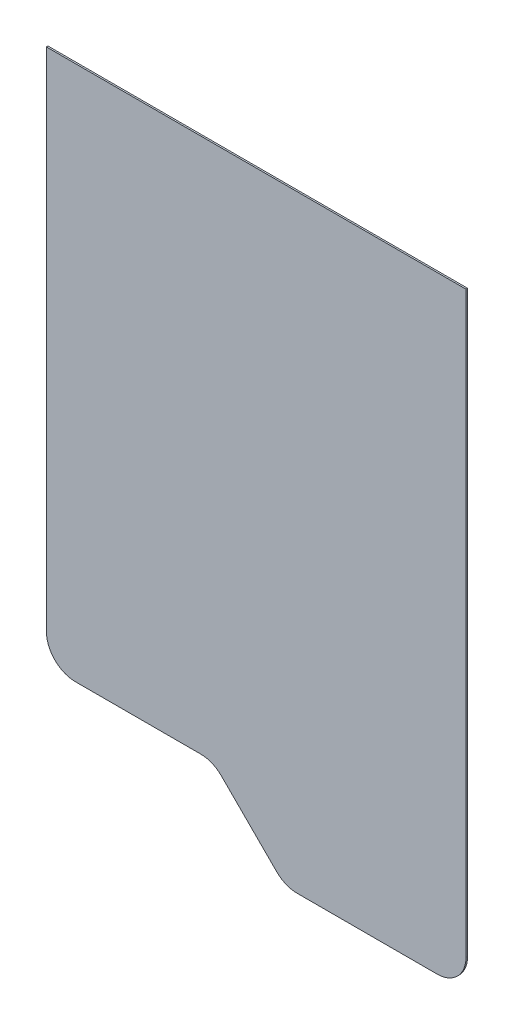
from build123d import *

# Parameters (mm, degrees)
BOSS_EXTRUDE1_DEPTH = 0.11
CUT_EXTRUDE1_DEPTH  = 62.727320532
BOSS_EXTRUDE2_START = -0.11
BOSS_EXTRUDE2_DEPTH = 0.11


with BuildPart() as part:
    # Sketch3 → Boss-Extrude1 (new body)
    with BuildSketch(Plane.XY):
        with BuildLine():
            Line((-12.5, 60), (4.5, 60))
            ThreePointArc((4.5, 60), (11.571067812, 57.071067812), (14.5, 50))
            Line((14.5, 50), (14.5, -58))
            ThreePointArc((14.5, -58), (13.914213562, -59.414213562), (12.5, -60))
            Line((12.5, -60), (-12.5, -60))
            ThreePointArc((-12.5, -60), (-13.914213562, -59.414213562), (-14.5, -58))
            Line((-14.5, -58), (-14.5, 58))
            ThreePointArc((-14.5, 58), (-13.914213562, 59.414213562), (-12.5, 60))
        make_face()
    extrude(amount=BOSS_EXTRUDE1_DEPTH)

    # Sketch4 → Cut-Extrude1 (cut, through all)
    with BuildSketch(Plane.XY.offset(0.11)):
        with BuildLine():
            Line((-14.5, -23), (14.5, -23))
            Line((14.5, -23), (14.5, 50))
            ThreePointArc((14.5, 50), (11.571067812, 57.071067812), (4.5, 60))
            Line((4.5, 60), (-12.5, 60))
            ThreePointArc((-12.5, 60), (-13.914213562, 59.414213562), (-14.5, 58))
            Line((-14.5, 58), (-14.5, -23))
        make_face()
    extrude(amount=-CUT_EXTRUDE1_DEPTH, mode=Mode.SUBTRACT)

    # Sketch5 → Boss-Extrude2 (add)
    with BuildSketch(Plane.XY.offset(0.11).offset(BOSS_EXTRUDE2_START)):
        with BuildLine():
            Line((14.5, -63), (14.5, -23))
            Line((14.5, -23), (-14.5, -23))
            Line((-14.5, -23), (-14.5, -58))
            ThreePointArc((-14.5, -58), (-13.914213562, -59.414213562), (-12.5, -60))
            Line((-12.5, -60), (-3.828427125, -60))
            ThreePointArc((-3.828427125, -60), (-3.06306026, -60.152240935), (-2.414213562, -60.585786438))
            Line((-2.414213562, -60.585786438), (1.414213562, -64.414213562))
            ThreePointArc((1.414213562, -64.414213562), (2.06306026, -64.847759065), (2.828427125, -65))
            Line((2.828427125, -65), (12.5, -65))
            ThreePointArc((12.5, -65), (13.914213562, -64.414213562), (14.5, -63))
        make_face()
    extrude(amount=BOSS_EXTRUDE2_DEPTH)


solid = part.part
